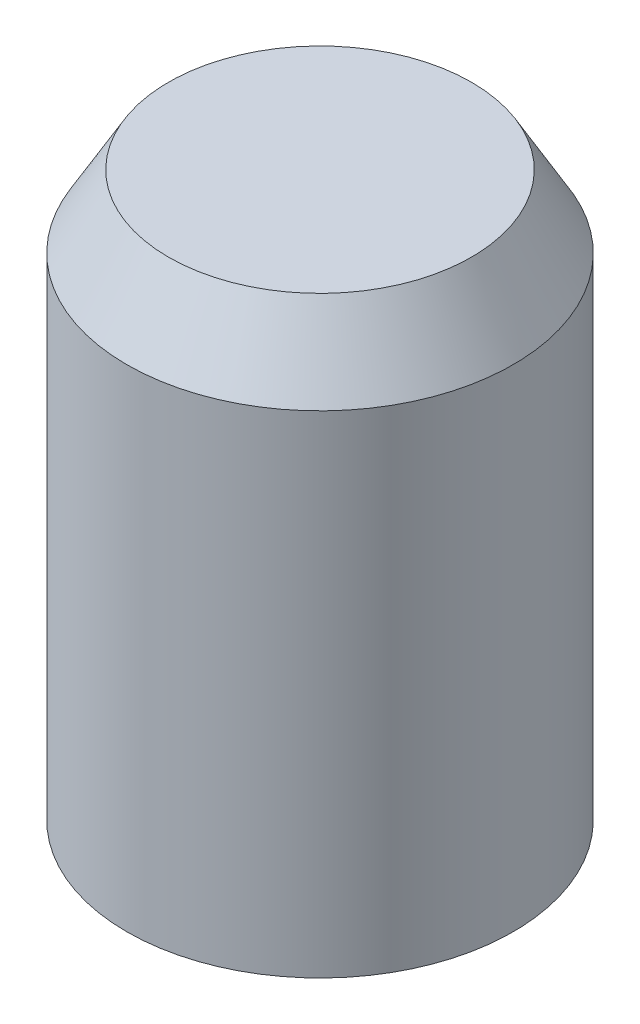
from build123d import *

# Parameters (mm, degrees)
SKETCH1_R           = 13.375
BOSS_EXTRUDE1_DEPTH = 39
CHAMFER1_SIZE       = 5
CHAMFER1_SIZE2      = 2.886751346


with BuildPart() as part:
    # Sketch1 → Boss-Extrude1 (new body)
    with BuildSketch(Plane(origin=(0, 0, 0), x_dir=(1, 0, 0), z_dir=(0, 1, 0))):
        with Locations(Location((0, 0, 0), (0, 0, 270))):
            Circle(SKETCH1_R)
    extrude(amount=BOSS_EXTRUDE1_DEPTH)

    # Chamfer1
    chamfer1_edges = [part.edges().sort_by_distance(p)[0] for p in [
        (0, 39, -13.375),
    ]]
    chamfer1_side = [part.faces().sort_by_distance(p)[0] for p in [
        (0, 19.5, -13.375),
    ]]
    chamfer(chamfer1_edges, length=CHAMFER1_SIZE, length2=CHAMFER1_SIZE2, reference=chamfer1_side[0])


solid = part.part
